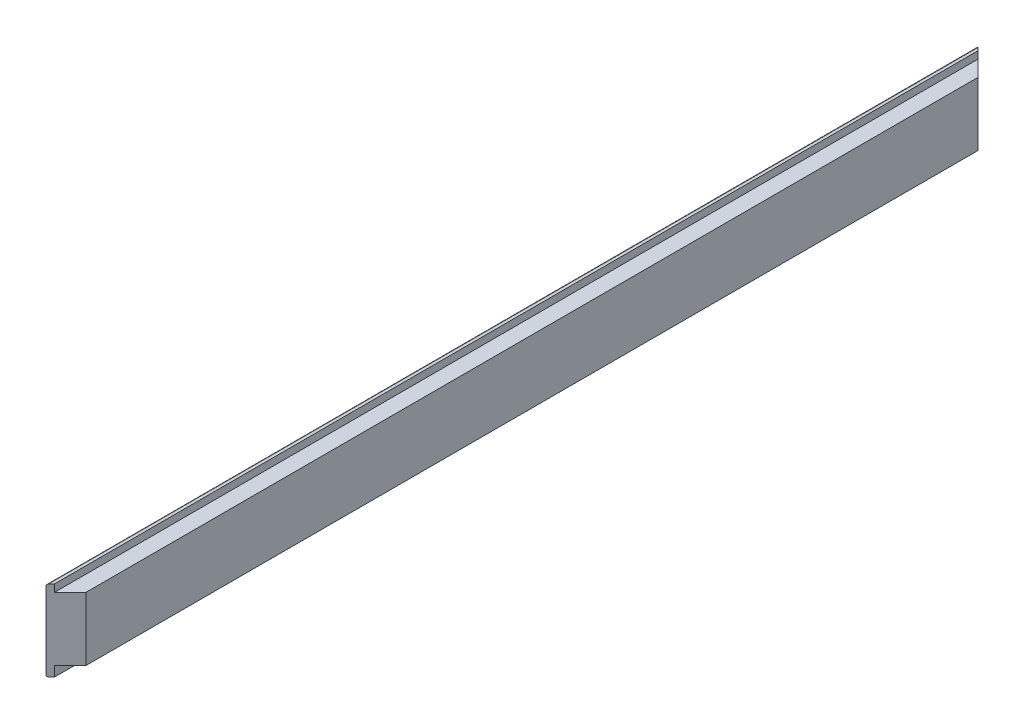
from build123d import *

# Parameters (mm, degrees)
BOSS_EXTRUDE1_DEPTH            = 444.55
FILLET1_R                      = 1.5875
CUT_EXTRUDE1_DEPTH             = 452.571262372
CUT_EXTRUDE1_DEPTH_BACK        = 452.571262372
F_7_9_7_9_DIAMETER_HOLE1_D     = 7.9
F_7_9_7_9_DIAMETER_HOLE1_DEPTH = 15
F_7_9_7_9_DIAMETER_HOLE1_TIP   = 2.373399445


with BuildPart() as part:
    # Sketch1 → Boss-Extrude1 (new, symmetric)
    with BuildSketch(Plane.XY):
        Polygon((0, 77), (0, 0), (4.05, 0), (4.05, 9.525), (19.05, 9.525), (19.05, 70), (4.05, 70), (4.05, 77), align=None)
    extrude(amount=BOSS_EXTRUDE1_DEPTH, both=True)

    # Fillet1
    fillet1_edges = [part.edges().sort_by_distance(p)[0] for p in [
        (0, 0, 0),
        (0, 77, 0),
    ]]
    fillet(fillet1_edges, radius=FILLET1_R)

    # Sketch2 → Cut-Extrude1 (cut, two sides: drawn at the far end of the back side and taken through both)
    with BuildSketch(Plane(origin=(0, 77, 0), x_dir=(1, 0, 0), z_dir=(0, 1, 0)).offset(-CUT_EXTRUDE1_DEPTH_BACK)):
        Polygon((0, -444.55), (19.05, -425.5), (19.05, -444.55), align=None)
        Polygon((0, 444.55), (19.05, 425.5), (19.05, 444.55), align=None)
    extrude(amount=CUT_EXTRUDE1_DEPTH + CUT_EXTRUDE1_DEPTH_BACK, mode=Mode.SUBTRACT)

    # Ø7.9 (7.9) Diameter Hole1
    with Locations(Plane(origin=(0, 9.525, 0), x_dir=(-1, 0, 0), z_dir=(0, -1, 0))):
        with Locations((-11.55, -410.5), (-11.55, 410.5), (-11.55, 0)):
            Hole(F_7_9_7_9_DIAMETER_HOLE1_D / 2, depth=F_7_9_7_9_DIAMETER_HOLE1_DEPTH)
            with Locations((0, 0, -(F_7_9_7_9_DIAMETER_HOLE1_DEPTH + F_7_9_7_9_DIAMETER_HOLE1_TIP / 2))):  # 118° drill point
                Cone(0, F_7_9_7_9_DIAMETER_HOLE1_D / 2, F_7_9_7_9_DIAMETER_HOLE1_TIP, mode=Mode.SUBTRACT)


solid = part.part
